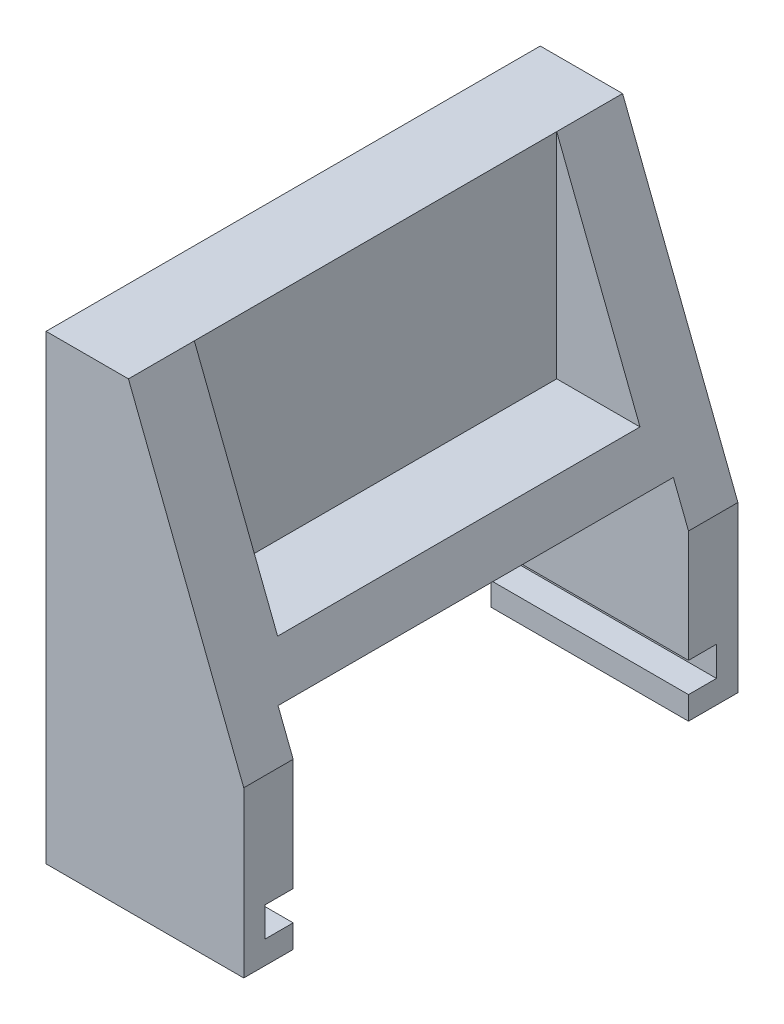
from build123d import *

# Parameters (mm, degrees)
BOSS_EXTRUDE1_DEPTH = 30
SKETCH4_W           = 24
SKETCH4_H           = 14
CUT_EXTRUDE2_DEPTH  = 25
SKETCH5_W           = 1.7
SKETCH5_H           = 1.8
CUT_EXTRUDE3_DEPTH  = 15
CUT_EXTRUDE4_DEPTH  = 11
BOSS_EXTRUDE2_DEPTH = 3
SKETCH8_R           = 1.25
BOSS_EXTRUDE3_DEPTH = 4
FILLET3_R           = 1


with BuildPart() as part:
    # Sketch1 → Boss-Extrude1 (new body)
    with BuildSketch(Plane.XY):
        Polygon((0, 0), (0, -28), (12, -28), (12, -18), (5, 0), align=None)
    extrude(amount=-BOSS_EXTRUDE1_DEPTH)

    # Sketch4 → Cut-Extrude2 (cut)
    with BuildSketch(Plane.ZY):
        with Locations((-15, -22.638599401)):
            Rectangle(SKETCH4_W, SKETCH4_H)
    extrude(amount=-CUT_EXTRUDE2_DEPTH, mode=Mode.SUBTRACT)

    # Sketch5 → Cut-Extrude3 (cut)
    with BuildSketch(Plane.ZY):
        with Locations((-2.15, -25.7)):
            Rectangle(SKETCH5_W, SKETCH5_H)
    cut_extrude3 = extrude(amount=-CUT_EXTRUDE3_DEPTH, mode=Mode.SUBTRACT)

    # Mirror1: Cut-Extrude3 across plane
    add(cut_extrude3.mirror(Plane.XY.offset(-15)), mode=Mode.SUBTRACT)

    # Sketch6 → Cut-Extrude4 (cut, symmetric)
    with BuildSketch(Plane.XY.offset(-15)):
        Polygon((5, 0), (5, -13), (10.055555556, -13), align=None)
    extrude(amount=CUT_EXTRUDE4_DEPTH, both=True, mode=Mode.SUBTRACT)

    # Sketch7 → Boss-Extrude2 (add)
    with BuildSketch(Plane(origin=(0, -15, 0), x_dir=(1, 0, 0), z_dir=(0, 1, 0))):
        Polygon((0, 15), (-3, 15), (-5.356060357, 18.232488143), (-8.356060357, 18.232488143), (-8.356060357, 15.232488143), (-6.881763998, 15.232488143), (-4.525703641, 12), (0, 12), align=None)
    extrude(amount=BOSS_EXTRUDE2_DEPTH)

    # Sketch8 → Boss-Extrude3 (add)
    with BuildSketch(Plane(origin=(0, -15, 0), x_dir=(-1, 0, 0), z_dir=(0, -1, 0))):
        with Locations(Location((6.856060357, 16.632488143, 0), (0, 0, 270))):
            Circle(SKETCH8_R)
    extrude(amount=BOSS_EXTRUDE3_DEPTH)

    # Fillet3
    fillet3_edges = [part.edges().sort_by_distance(p)[0] for p in [
        (-6.856060357, -19, -17.882488143),
    ]]
    fillet(fillet3_edges, radius=FILLET3_R)


solid = part.part
